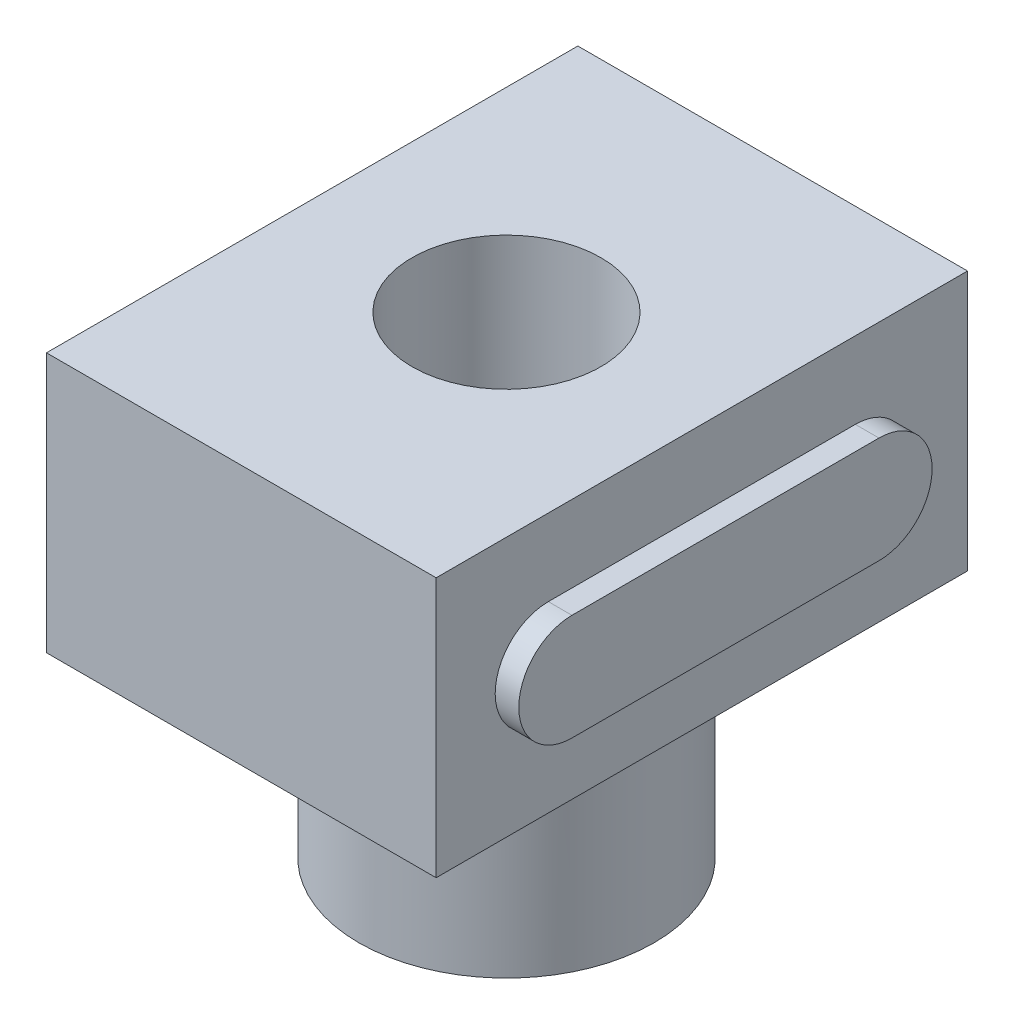
from build123d import *

# Parameters (mm, degrees)
ESBO_O1_R                = 12.5
RESSALTO_EXTRUS_O1_DEPTH = 30
ESBO_O2_R                = 8
CORTE_EXTRUS_O1_DEPTH    = 15
ESBO_O3_W                = 3
ESBO_O3_H                = 5
CORTE_EXTRUS_O2_DEPTH    = 6.5
ESBO_O4_R                = 8
CORTE_EXTRUS_O3_DEPTH    = 35.820970693
ESBO_O5_W                = 25
ESBO_O5_H                = 25
RESSALTO_EXTRUS_O2_DEPTH = 12
ESBO_O6_W                = 25
ESBO_O6_H                = 25
RESSALTO_EXTRUS_O3_DEPTH = 10
ESBO_O7_R                = 8
CORTE_EXTRUS_O4_DEPTH    = 29.222331583
ESBO_O8_W                = 45
ESBO_O8_H                = 22
RESSALTO_EXTRUS_O4_DEPTH = 25
ESBO_O9_W                = 45.089311088
ESBO_O9_H                = 22
RESSALTO_EXTRUS_O5_DEPTH = 4
ESBO_O10_W               = 45.089311088
ESBO_O10_H               = 22
RESSALTO_EXTRUS_O6_DEPTH = 4
ESBO_O11_W               = 33
ESBO_O11_H               = 45
RESSALTO_EXTRUS_O7_DEPTH = 22
ESBO_O12_W               = 4
ESBO_O12_H               = 0.089311088
CORTE_EXTRUS_O5_DEPTH    = 49.790485687
RESSALTO_EXTRUS_O8_DEPTH = 2
RESSALTO_EXTRUS_O9_START = 2
RESSALTO_EXTRUS_O9_DEPTH = 2
ESBO_O15_R               = 8
CORTE_EXTRUS_O6_DEPTH    = 37.530966229


with BuildPart() as part:
    # Esboço1 → Ressalto-extrusão1 (new body)
    with BuildSketch(Plane(origin=(0, 0, 0), x_dir=(1, 0, 0), z_dir=(0, 1, 0))):
        with Locations(Location((0, 0, 0), (0, 0, 270))):
            Circle(ESBO_O1_R)
    extrude(amount=RESSALTO_EXTRUS_O1_DEPTH)

    # Esboço2 → Corte-extrusão1 (cut)
    with BuildSketch(Plane(origin=(0, 30, 0), x_dir=(1, 0, 0), z_dir=(0, 1, 0))):
        with Locations(Location((0, 0, 0), (0, 0, 270))):
            Circle(ESBO_O2_R)
    extrude(amount=-CORTE_EXTRUS_O1_DEPTH, mode=Mode.SUBTRACT)

    # Esboço3 → Corte-extrusão2 (cut)
    with BuildSketch(Plane.XZ):
        Rectangle(ESBO_O3_W, ESBO_O3_H)
    extrude(amount=-CORTE_EXTRUS_O2_DEPTH, mode=Mode.SUBTRACT)

    # Esboço4 → Corte-extrusão3 (cut, through all)
    with BuildSketch(Plane(origin=(0, 30, 0), x_dir=(1, 0, 0), z_dir=(0, 1, 0))):
        with Locations(Location((0, 0, 0), (0, 0, 270))):
            Circle(ESBO_O4_R)
    extrude(amount=-CORTE_EXTRUS_O3_DEPTH, mode=Mode.SUBTRACT)

    # Esboço5 → Ressalto-extrusão2 (add)
    with BuildSketch(Plane(origin=(0, 30, 0), x_dir=(1, 0, 0), z_dir=(0, 1, 0))):
        Rectangle(ESBO_O5_W, ESBO_O5_H)
    extrude(amount=-RESSALTO_EXTRUS_O2_DEPTH)

    # Esboço6 → Ressalto-extrusão3 (add)
    with BuildSketch(Plane(origin=(0, 30, 0), x_dir=(1, 0, 0), z_dir=(0, 1, 0))):
        Rectangle(ESBO_O6_W, ESBO_O6_H)
    extrude(amount=RESSALTO_EXTRUS_O3_DEPTH)

    # Esboço7 → Corte-extrusão4 (cut, through all)
    with BuildSketch(Plane.XZ.offset(-18)):
        with Locations(Location((0, 0, 0), (0, 0, 90))):
            Circle(ESBO_O7_R)
    extrude(amount=-CORTE_EXTRUS_O4_DEPTH, mode=Mode.SUBTRACT)

    # Esboço8 → Ressalto-extrusão4 (add)
    with BuildSketch(Plane(origin=(12.5, 0, 0), x_dir=(0, 0, -1), z_dir=(1, 0, 0))):
        with Locations((0.044655544, 29)):
            Rectangle(ESBO_O8_W, ESBO_O8_H)
    extrude(amount=-RESSALTO_EXTRUS_O4_DEPTH)

    # Esboço9 → Ressalto-extrusão5 (add)
    with BuildSketch(Plane.ZY.offset(12.5)):
        with Locations((0, 29)):
            Rectangle(ESBO_O9_W, ESBO_O9_H)
    extrude(amount=RESSALTO_EXTRUS_O5_DEPTH)

    # Esboço10 → Ressalto-extrusão6 (add)
    with BuildSketch(Plane(origin=(12.5, 0, 0), x_dir=(0, 0, -1), z_dir=(1, 0, 0))):
        with Locations((0, 29)):
            Rectangle(ESBO_O10_W, ESBO_O10_H)
    extrude(amount=RESSALTO_EXTRUS_O6_DEPTH)

    # Esboço11 → Ressalto-extrusão7 (add)
    with BuildSketch(Plane(origin=(0, 40, 0), x_dir=(1, 0, 0), z_dir=(0, 1, 0))):
        with Locations((0, 0.044655544)):
            Rectangle(ESBO_O11_W, ESBO_O11_H)
    extrude(amount=-RESSALTO_EXTRUS_O7_DEPTH)

    # Esboço12 → Corte-extrusão5 (cut, through all)
    with BuildSketch(Plane(origin=(0, 40, 0), x_dir=(1, 0, 0), z_dir=(0, 1, 0))):
        with Locations((-14.5, -22.5)):
            Rectangle(ESBO_O12_W, ESBO_O12_H)
        with Locations((14.5, -22.5)):
            Rectangle(ESBO_O12_W, ESBO_O12_H)
    extrude(amount=-CORTE_EXTRUS_O5_DEPTH, mode=Mode.SUBTRACT)

    # Esboço13 → Ressalto-extrusão8 (add)
    with BuildSketch(Plane.ZY.offset(16.5)):
        with BuildLine():
            Line((-13.044655544, 33.5), (12.955344456, 33.5))
            ThreePointArc((12.955344456, 33.5), (17.455344456, 29), (12.955344456, 24.5))
            Line((12.955344456, 24.5), (-13.044655544, 24.5))
            ThreePointArc((-13.044655544, 24.5), (-17.544655544, 29), (-13.044655544, 33.5))
        make_face()
    extrude(amount=RESSALTO_EXTRUS_O8_DEPTH)

    # Esboço14 → Ressalto-extrusão9 (add)
    with BuildSketch(Plane(origin=(16.5, 0, 0), x_dir=(0, 0, -1), z_dir=(1, 0, 0)).offset(RESSALTO_EXTRUS_O9_START)):
        with BuildLine():
            Line((-12.955344456, 24.5), (13.044655544, 24.5))
            ThreePointArc((13.044655544, 24.5), (17.544655544, 29), (13.044655544, 33.5))
            Line((13.044655544, 33.5), (-12.955344456, 33.5))
            ThreePointArc((-12.955344456, 33.5), (-17.455344456, 29), (-12.955344456, 24.5))
        make_face()
    extrude(amount=-RESSALTO_EXTRUS_O9_DEPTH)

    # Esboço15 → Corte-extrusão6 (cut, through all)
    with BuildSketch(Plane.XZ.offset(-18)):
        with Locations(Location((0, 0, 0), (0, 0, 90))):
            Circle(ESBO_O15_R)
    extrude(amount=-CORTE_EXTRUS_O6_DEPTH, mode=Mode.SUBTRACT)


solid = part.part
